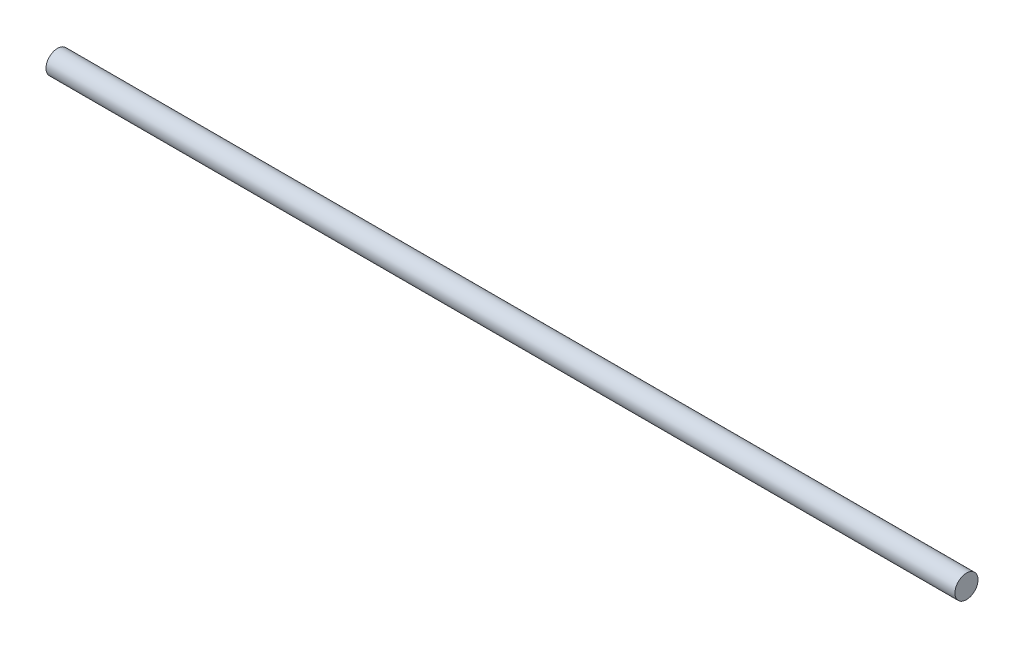
from build123d import *

# Parameters (mm, degrees)
SKETCH1_R           = 12.7
BOSS_EXTRUDE1_DEPTH = 1000


with BuildPart() as part:
    # Sketch1 → Boss-Extrude1 (new body)
    with BuildSketch(Plane(origin=(0, 0, 0), x_dir=(0, 0, -1), z_dir=(1, 0, 0))):
        Circle(SKETCH1_R)
    extrude(amount=BOSS_EXTRUDE1_DEPTH)


solid = part.part
